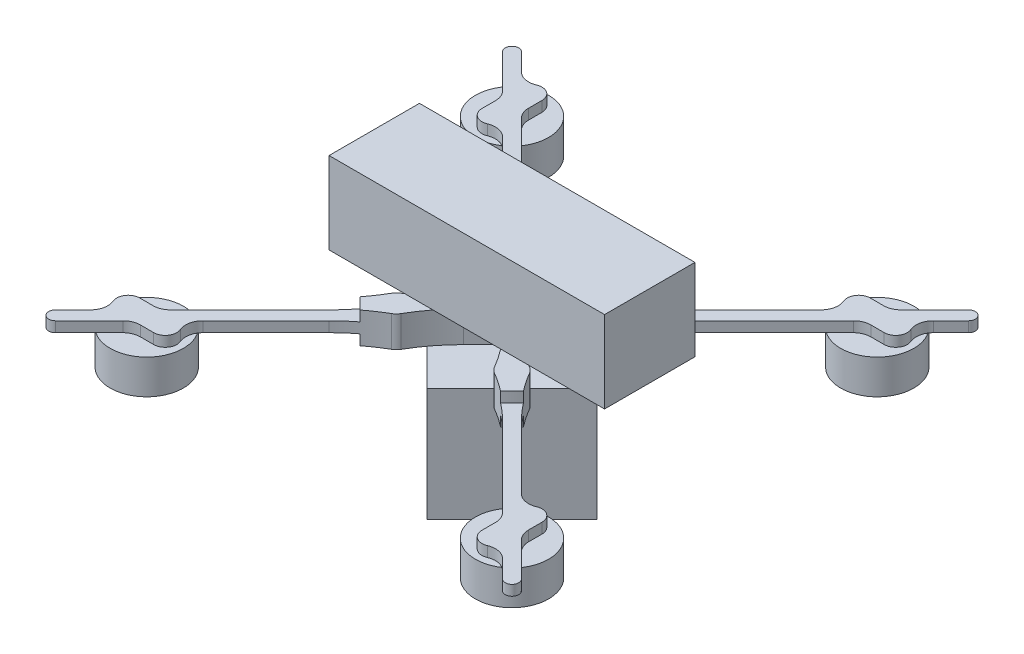
from build123d import *

# Parameters (mm, degrees)
BOSS_EXTRUDE1_DEPTH      = 2.4
SKETCH6_R                = 8.5
BOSS_EXTRUDE5_DEPTH      = 8
FILLET1_R                = 4
FILLET2_R                = 40
CIRPATTERN3_COUNT        = 4
CIRPATTERN1_COUNT        = 4
FILLET1_OF_CIRPATTERN1_R = 4
FILLET2_OF_CIRPATTERN1_R = 40
BOSS_EXTRUDE2_DEPTH      = 2.4
BOSS_EXTRUDE2_DEPTH_BACK = 4.8
BOSS_EXTRUDE3_DEPTH      = 26.4
SKETCH5_W                = 64
SKETCH5_H                = 21
BOSS_EXTRUDE4_DEPTH      = 19


with BuildPart() as part:
    # Sketch1 → Boss-Extrude1 (new body)
    with BuildSketch(Plane(origin=(0, 0, 0), x_dir=(1, 0, 0), z_dir=(0, 1, 0))):
        with BuildLine():
            ThreePointArc((-45.101406871, 38.126406871), (-42.685962407, 35.464029001), (-39.801776274, 37.609745252))
            Line((-39.801776274, 37.609745252), (-16.347290482, 14.15525946))
            ThreePointArc((-16.347290482, 14.15525946), (-15.556349186, 11.313708499), (-12.714798225, 10.522767203))
            Line((-12.714798225, 10.522767203), (-2.192031022, 0))
            Line((-2.192031022, 0), (0, 0))
            Line((0, 0), (0, 2.192031022))
            Line((0, 2.192031022), (-10.522767203, 12.714798225))
            ThreePointArc((-10.522767203, 12.714798225), (-11.313708499, 15.556349186), (-14.15525946, 16.347290482))
            Line((-14.15525946, 16.347290482), (-39.751406871, 41.943437893))
            Line((-39.751406871, 41.943437893), (-39.751406871, 46.726406871))
            ThreePointArc((-39.751406871, 46.726406871), (-42.166851335, 49.388784741), (-45.051037468, 47.24306849))
            Line((-45.051037468, 47.24306849), (-51.936993078, 54.1290241))
            ThreePointArc((-51.936993078, 54.1290241), (-54.1290241, 54.1290241), (-54.1290241, 51.936993078))
            Line((-54.1290241, 51.936993078), (-45.101406871, 42.90937585))
            Line((-45.101406871, 42.90937585), (-45.101406871, 38.126406871))
        make_face()
    boss_extrude1 = extrude(amount=BOSS_EXTRUDE1_DEPTH)

    # Fillet1
    fillet1_edges = [part.edges().sort_by_distance(p)[0] for p in [
        (-45.051037468, 1.2, -47.24306849),
        (-45.101406871, 1.2, -42.90937585),
        (-39.801776274, 1.2, -37.609745252),
        (-39.751406871, 1.2, -41.943437893),
    ]]
    fillet(fillet1_edges, radius=FILLET1_R)

    # Fillet2
    fillet2_edges = [part.edges().sort_by_distance(p)[0] for p in [
        (-10.522767203, 1.2, -12.714798225),
        (-12.714798225, 1.2, -10.522767203),
        (-16.347290482, 1.2, -14.15525946),
        (-14.15525946, 1.2, -16.347290482),
    ]]
    fillet(fillet2_edges, radius=FILLET2_R)

    # CirPattern1: Boss-Extrude1 ×4 about axis
    cirpattern1_axis = Axis((0, 0, 0), (0, 1, 0))
    for i in range(1, CIRPATTERN1_COUNT):
        add(boss_extrude1.rotate(cirpattern1_axis, i * 360 / CIRPATTERN1_COUNT))

    # Fillet1 of CirPattern1
    fillet1_of_cirpattern1_edges = [part.edges().sort_by_distance(p)[0] for p in [
        (-47.24306849, 1.2, 45.051037468),
        (-42.90937585, 1.2, 45.101406871),
        (-37.609745252, 1.2, 39.801776274),
        (-41.943437893, 1.2, 39.751406871),
        (45.051037468, 1.2, 47.24306849),
        (45.101406871, 1.2, 42.90937585),
        (39.801776274, 1.2, 37.609745252),
        (39.751406871, 1.2, 41.943437893),
        (47.24306849, 1.2, -45.051037468),
        (42.90937585, 1.2, -45.101406871),
        (37.609745252, 1.2, -39.801776274),
        (41.943437893, 1.2, -39.751406871),
    ]]
    fillet(fillet1_of_cirpattern1_edges, radius=FILLET1_OF_CIRPATTERN1_R)

    # Fillet2 of CirPattern1
    fillet2_of_cirpattern1_edges = [part.edges().sort_by_distance(p)[0] for p in [
        (-12.714798225, 1.2, 10.522767203),
        (-10.522767203, 1.2, 12.714798225),
        (-14.15525946, 1.2, 16.347290482),
        (-16.347290482, 1.2, 14.15525946),
        (10.522767203, 1.2, 12.714798225),
        (12.714798225, 1.2, 10.522767203),
        (16.347290482, 1.2, 14.15525946),
        (14.15525946, 1.2, 16.347290482),
        (12.714798225, 1.2, -10.522767203),
        (10.522767203, 1.2, -12.714798225),
        (14.15525946, 1.2, -16.347290482),
        (16.347290482, 1.2, -14.15525946),
    ]]
    fillet(fillet2_of_cirpattern1_edges, radius=FILLET2_OF_CIRPATTERN1_R)

    # Sketch3 → Boss-Extrude2 (add, two sides: drawn at the far end of the back side and taken through both)
    with BuildSketch(Plane(origin=(0, 2.4, 0), x_dir=(1, 0, 0), z_dir=(0, 1, 0)).offset(-BOSS_EXTRUDE2_DEPTH_BACK)):
        with BuildLine():
            Line((-6.701692528, 4.509661507), (-2.192031022, 0))
            Line((-2.192031022, 0), (-6.701692528, -4.509661507))
            ThreePointArc((-6.701692528, -4.509661507), (-10.613801056, -7.94285681), (-14.938582443, -10.839007546))
            ThreePointArc((-14.938582443, -10.839007546), (-15.556349186, -11.313708499), (-16.031050139, -11.931475243))
            ThreePointArc((-16.031050139, -11.931475243), (-17.423483596, -14.163073799), (-18.959575897, -16.298331042))
            ThreePointArc((-18.959575897, -16.298331042), (-17.679099425, -17.679099425), (-16.298331042, -18.959575897))
            ThreePointArc((-16.298331042, -18.959575897), (-14.163073799, -17.423483596), (-11.931475243, -16.031050139))
            ThreePointArc((-11.931475243, -16.031050139), (-11.313708499, -15.556349186), (-10.839007546, -14.938582443))
            ThreePointArc((-10.839007546, -14.938582443), (-7.94285681, -10.613801056), (-4.509661507, -6.701692528))
            Line((-4.509661507, -6.701692528), (0, -2.192031022))
            Line((0, -2.192031022), (4.509661507, -6.701692528))
            ThreePointArc((4.509661507, -6.701692528), (7.94285681, -10.613801056), (10.839007546, -14.938582443))
            ThreePointArc((10.839007546, -14.938582443), (11.313708499, -15.556349186), (11.931475243, -16.031050139))
            ThreePointArc((11.931475243, -16.031050139), (14.163073799, -17.423483596), (16.298331042, -18.959575897))
            ThreePointArc((16.298331042, -18.959575897), (17.679099425, -17.679099425), (18.959575897, -16.298331042))
            ThreePointArc((18.959575897, -16.298331042), (17.423483596, -14.163073799), (16.031050139, -11.931475243))
            ThreePointArc((16.031050139, -11.931475243), (15.556349186, -11.313708499), (14.938582443, -10.839007546))
            ThreePointArc((14.938582443, -10.839007546), (10.613801056, -7.94285681), (6.701692528, -4.509661507))
            Line((6.701692528, -4.509661507), (2.192031022, 0))
            Line((2.192031022, 0), (6.701692528, 4.509661507))
            ThreePointArc((6.701692528, 4.509661507), (10.613801056, 7.94285681), (14.938582443, 10.839007546))
            ThreePointArc((14.938582443, 10.839007546), (15.556349186, 11.313708499), (16.031050139, 11.931475243))
            ThreePointArc((16.031050139, 11.931475243), (17.423483596, 14.163073799), (18.959575897, 16.298331042))
            ThreePointArc((18.959575897, 16.298331042), (17.679099425, 17.679099425), (16.298331042, 18.959575897))
            ThreePointArc((16.298331042, 18.959575897), (14.163073799, 17.423483596), (11.931475243, 16.031050139))
            ThreePointArc((11.931475243, 16.031050139), (11.313708499, 15.556349186), (10.839007546, 14.938582443))
            ThreePointArc((10.839007546, 14.938582443), (7.94285681, 10.613801056), (4.509661507, 6.701692528))
            Line((4.509661507, 6.701692528), (0, 2.192031022))
            Line((0, 2.192031022), (-4.509661507, 6.701692528))
            ThreePointArc((-4.509661507, 6.701692528), (-7.94285681, 10.613801056), (-10.839007546, 14.938582443))
            ThreePointArc((-10.839007546, 14.938582443), (-11.313708499, 15.556349186), (-11.931475243, 16.031050139))
            ThreePointArc((-11.931475243, 16.031050139), (-14.163073799, 17.423483596), (-16.298331042, 18.959575897))
            ThreePointArc((-16.298331042, 18.959575897), (-17.679099425, 17.679099425), (-18.959575897, 16.298331042))
            ThreePointArc((-18.959575897, 16.298331042), (-17.423483596, 14.163073799), (-16.031050139, 11.931475243))
            ThreePointArc((-16.031050139, 11.931475243), (-15.556349186, 11.313708499), (-14.938582443, 10.839007546))
            ThreePointArc((-14.938582443, 10.839007546), (-10.613801056, 7.94285681), (-6.701692528, 4.509661507))
        make_face()
    extrude(amount=BOSS_EXTRUDE2_DEPTH + BOSS_EXTRUDE2_DEPTH_BACK)


with BuildPart() as body_2:
    # Sketch6 → Boss-Extrude5 (new body)
    with BuildSketch(Plane.XZ):
        with Locations(Location((-42.426406871, -42.426406871, 0), (0, 0, 270))):
            Circle(SKETCH6_R)
    extrude(amount=BOSS_EXTRUDE5_DEPTH)


with BuildPart() as cirpattern3_1:
    # CirPattern3: pattern copy
    add(body_2.part.rotate(Axis((0, 0, 0), (0, 1, 0)), 1 * 360 / CIRPATTERN3_COUNT))


with BuildPart() as cirpattern3_2:
    # CirPattern3: pattern copy
    add(body_2.part.rotate(Axis((0, 0, 0), (0, 1, 0)), 2 * 360 / CIRPATTERN3_COUNT))


with BuildPart() as cirpattern3_3:
    # CirPattern3: pattern copy
    add(body_2.part.rotate(Axis((0, 0, 0), (0, 1, 0)), 3 * 360 / CIRPATTERN3_COUNT))


with BuildPart() as body_6:
    # Sketch4 → Boss-Extrude3 (new body)
    with BuildSketch(Plane.XZ.offset(2.4)):
        Polygon((-19.798989873, 0), (0, -19.798989873), (19.798989873, 0), (0, 19.798989873), align=None)
    extrude(amount=BOSS_EXTRUDE3_DEPTH)


with BuildPart() as body_7:
    # Sketch5 → Boss-Extrude4 (new body)
    with BuildSketch(Plane(origin=(0, 4.8, 0), x_dir=(1, 0, 0), z_dir=(0, 1, 0))):
        Rectangle(SKETCH5_W, SKETCH5_H)
    extrude(amount=BOSS_EXTRUDE4_DEPTH)


solid = Compound([part.part, body_2.part, cirpattern3_1.part, cirpattern3_2.part, cirpattern3_3.part, body_6.part, body_7.part])
